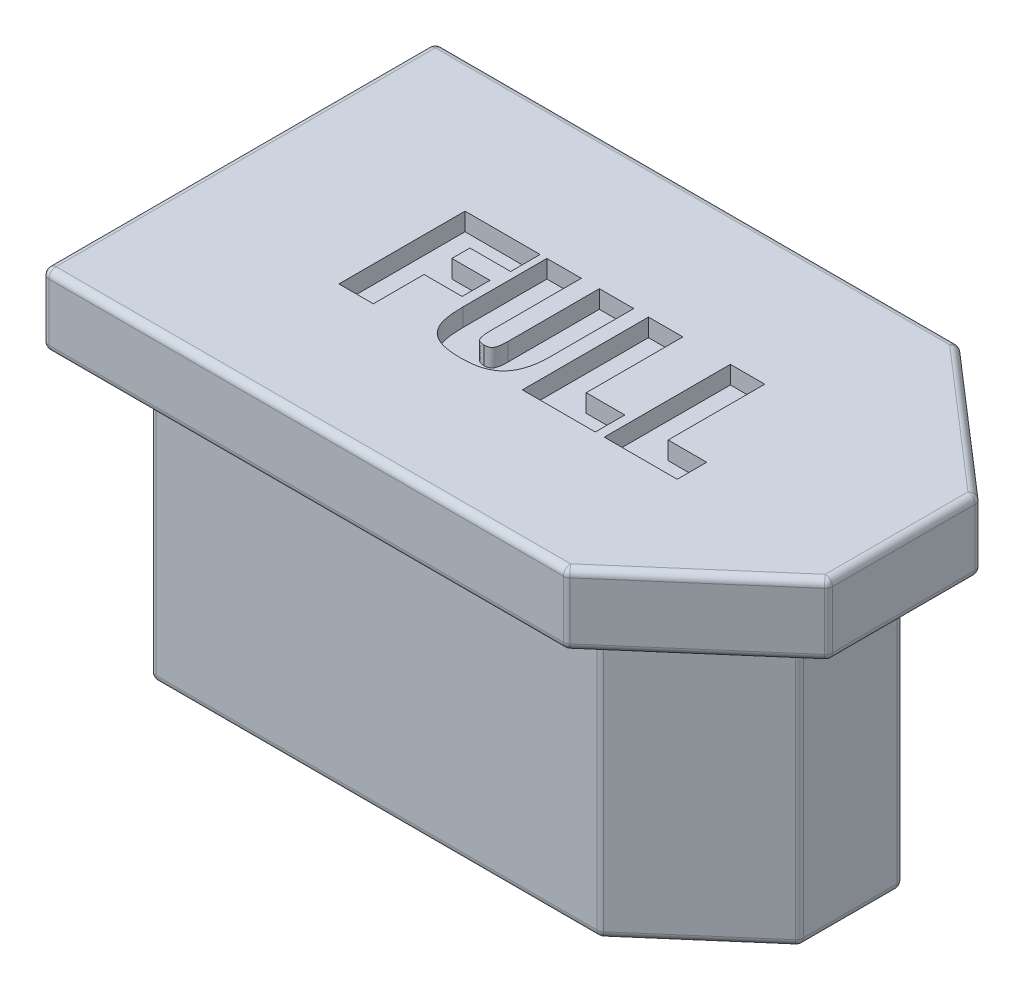
from build123d import *

# Parameters (mm, degrees)
BOSS_EXTRUDE1_DEPTH = 4
SHELL1_T            = -0.8
BOSS_EXTRUDE2_DEPTH = 2
BOSS_EXTRUDE4_REACH = 16.722
SKETCH4_W           = 2
SKETCH4_H           = 1.2
SKETCH5_W           = 1.1
SKETCH5_H           = 4
CUT_EXTRUDE1_DEPTH  = 1
FILLET1_R           = 0.2
CUT_EXTRUDE2_DEPTH  = 0.5


with BuildPart() as part:
    # Sketch1 → Boss-Extrude1 (new, symmetric)
    with BuildSketch(Plane(origin=(0, 0, 0), x_dir=(1, 0, 0), z_dir=(0, 1, 0))):
        Polygon((-7.800231879, 4), (4.799768121, 4), (7.800231879, 1.4), (7.800231879, -1.4), (4.799768121, -4), (-7.800231879, -4), align=None)
    extrude(amount=BOSS_EXTRUDE1_DEPTH, both=True)

    # Shell1
    shell1_openings = [part.faces().sort_by_distance(p)[0] for p in [
        (-0.453398861, 4, 0),
        (-0.453398861, -4, 0),
    ]]
    offset(amount=SHELL1_T, openings=shell1_openings, kind=Kind.INTERSECTION)

    # Sketch2 → Boss-Extrude2 (add)
    with BuildSketch(Plane(origin=(0, 4, 0), x_dir=(1, 0, 0), z_dir=(0, 1, 0))):
        Polygon((-9.300231879, 5.5), (-9.300231879, -5.5), (5.359252751, -5.5), (9.300231879, -2.085012665), (9.300231879, 2.085012665), (5.359252751, 5.5), align=None)
    extrude(amount=BOSS_EXTRUDE2_DEPTH)

    # Sketch4 → Boss-Extrude4 (add, up to next)
    with BuildSketch(Plane.XZ.offset(4), mode=Mode.PRIVATE) as boss_extrude4_sk1:
        with Locations((-0.000231879, -2.6)):
            Rectangle(SKETCH4_W, SKETCH4_H)
    boss_extrude4_tool1 = extrude(boss_extrude4_sk1.sketch, amount=-BOSS_EXTRUDE4_REACH, mode=Mode.PRIVATE) - part.part
    add(boss_extrude4_tool1.solids().sort_by_distance((-0.000232, -4, -2.6))[0])

    # Sketch5 → Cut-Extrude1 (cut)
    with BuildSketch(Plane.XZ.offset(-4)):
        with Locations((-0.000231879, 0)):
            Rectangle(SKETCH5_W, SKETCH5_H)
    extrude(amount=-CUT_EXTRUDE1_DEPTH, mode=Mode.SUBTRACT)

    # Fillet1
    fillet1_edges = [part.edges().sort_by_distance(p)[0] for p in [
        (6.3, 4, 2.7),
        (-7.800231879, 0, -4),
        (4.799768121, 0, -4),
        (7.800231879, 0, -1.4),
        (7.800231879, 0, 1.4),
        (4.799768121, 0, 4),
        (-7.800231879, 0, 4),
        (7.800231879, 4, 0),
        (6.3, 4, -2.7),
        (-1.500231879, 4, -4),
        (-7.000231879, -4, 0),
        (-7.000231879, 0, -3.2),
        (-1.249427781, -4, 3.2),
        (-7.000231879, 0, 3.2),
        (5.750804099, -4, 2.117329956),
        (4.501376318, 0, 3.2),
        (7.000231879, -4, 0),
        (7.000231879, 0, 1.034659912),
        (5.750804099, -4, -2.117329956),
        (7.000231879, 0, -1.034659912),
        (2.750572219, -4, -3.2),
        (4.501376318, 0, -3.2),
        (-7.000231879, 4, 0),
        (-1.249427781, 4, 3.2),
        (5.750804099, 4, 2.117329956),
        (7.000231879, 4, 0),
        (5.750804099, 4, -2.117329956),
        (2.750572219, 4, -3.2),
        (-1.970489564, 4, -5.5),
        (5.359252751, 5, -5.5),
        (-9.300231879, 4, 0),
        (-9.300231879, 5, -5.5),
        (-1.970489564, 4, 5.5),
        (-9.300231879, 5, 5.5),
        (7.329742315, 4, 3.792506333),
        (5.359252751, 5, 5.5),
        (9.300231879, 4, 0),
        (9.300231879, 5, 2.085012665),
        (7.329742315, 4, -3.792506333),
        (9.300231879, 5, -2.085012665),
        (-1.970489564, 6, -5.5),
        (-9.300231879, 6, 0),
        (-1.970489564, 6, 5.5),
        (7.329742315, 6, 3.792506333),
        (-7.800231879, 4, 0),
        (9.300231879, 6, 0),
        (7.329742315, 6, -3.792506333),
        (-4.000231879, 4, -3.2),
        (-1.500231879, -4, -4),
        (-4.000231879, -4, -3.2),
        (0.999768121, 0, -3.2),
        (-1.000231879, 4, -2.6),
        (-1.000231879, 0, -3.2),
        (0.774768121, 4, -2),
        (-1.000231879, 0, -2),
        (0.999768121, 4, -2.6),
        (0.999768121, 0, -2),
        (0.999768121, -4, -2.6),
        (-0.000231879, -4, -2),
        (-1.000231879, -4, -2.6),
        (6.3, -4, -2.7),
        (7.800231879, -4, 0),
        (-1.500231879, 4, 4),
        (6.3, -4, 2.7),
        (-0.775231879, 4, -2),
        (-1.500231879, -4, 4),
        (-0.000231879, 5, -2),
        (0.549768121, 4.5, -2),
        (-0.550231879, 5, 0),
        (-0.550231879, 4.5, -2),
        (-0.000231879, 5, 2),
        (-0.550231879, 4.5, 2),
        (0.549768121, 5, 0),
        (0.549768121, 4.5, 2),
        (0.549768121, 4, 0),
        (-0.000231879, 4, 2),
        (-0.550231879, 4, 0),
        (-7.800231879, -4, 0),
    ]]
    fillet(fillet1_edges, radius=FILLET1_R)

    # Sketch6 → Cut-Extrude2 (cut)
    with BuildSketch(Plane(origin=(0, 6, 0), x_dir=(1, 0, 0), z_dir=(0, 1, 0))):
        Polygon((-4.729610488, 1.763183333), (-2.630105658, 1.763183333), (-2.630105658, 0.938837879), (-3.767874124, 0.938837879), (-3.767874124, 0.435071212), (-2.704525734, 0.435071212), (-2.704525734, -0.343477273), (-3.767874124, -0.343477273), (-3.767874124, -1.763183333), (-4.729610488, -1.763183333), align=None)
        with BuildLine():
            Line((-0.974258973, 1.763183333), (-0.012522609, 1.763183333))
            Line((-0.012522609, 1.763183333), (-0.012522609, -0.582480208))
            add(Edge.make_bspline(
                [(-0.012522609, -0.582480208), (-0.013074538, -0.682044341), (-0.018871843, -0.827349384), (-0.050027891, -1.012483298), (-0.079237437, -1.137533649), (-0.118839295, -1.252460511), (-0.16648501, -1.357917428), (-0.224210632, -1.452631609), (-0.289561949, -1.538412572), (-0.365653341, -1.614171941), (-0.454278799, -1.678748395), (-0.554132011, -1.734173119), (-0.666295124, -1.777972128), (-0.789297045, -1.813476639), (-0.97670379, -1.845869926), (-1.124212944, -1.855100896), (-1.226142306, -1.854777273)],
                knots=[0, 0, 0, 0, 0.147091771, 0.213812555, 0.276818101, 0.336371325, 0.392915056, 0.447245077, 0.499696578, 0.551716391, 0.605080018, 0.661012388, 0.719773935, 0.782386932, 0.849634869, 1, 1, 1, 1], degree=3))
            add(Edge.make_bspline(
                [(-1.226142306, -1.854777273), (-1.335696933, -1.853598838), (-1.493540599, -1.848307146), (-1.691465292, -1.815233765), (-1.818090486, -1.783702772), (-1.930740252, -1.741372046), (-2.030450296, -1.687980633), (-2.118686541, -1.624868177), (-2.195040699, -1.550915118), (-2.259157986, -1.465805045), (-2.312988749, -1.370783365), (-2.356155802, -1.265216152), (-2.387752365, -1.148963406), (-2.410650726, -1.022432395), (-2.434574705, -0.832987442), (-2.439081919, -0.684631157), (-2.439762003, -0.582480208)],
                knots=[0, 0, 0, 0, 0.159500308, 0.228770628, 0.291433921, 0.348949481, 0.403253485, 0.455420347, 0.506186304, 0.557166208, 0.609816123, 0.664556878, 0.722530636, 0.784630014, 0.851388542, 1, 1, 1, 1], degree=3))
            Line((-2.439762003, -0.582480208), (-2.439762003, 1.763183333))
            Line((-2.439762003, 1.763183333), (-1.478025639, 1.763183333))
            Line((-1.478025639, 1.763183333), (-1.478025639, -0.784273106))
            add(Edge.make_bspline(
                [(-1.478025639, -0.784273106), (-1.47702952, -0.850008176), (-1.475898145, -0.94203407), (-1.453854653, -1.051706798), (-1.43524811, -1.112642268), (-1.403845733, -1.160637829), (-1.335235205, -1.205975479), (-1.270259157, -1.213013376), (-1.226142306, -1.213619697)],
                knots=[0, 0, 0, 0, 0.343473968, 0.475215467, 0.581631525, 0.673591657, 0.767279203, 1, 1, 1, 1], degree=3))
            add(Edge.make_bspline(
                [(-1.226142306, -1.213619697), (-1.182025455, -1.213013376), (-1.117049407, -1.205975479), (-1.048438879, -1.160637829), (-1.017036501, -1.112642268), (-0.998429959, -1.051706798), (-0.976386467, -0.94203407), (-0.975255092, -0.850008176), (-0.974258973, -0.784273106)],
                knots=[0, 0, 0, 0, 0.232720797, 0.326408343, 0.418368475, 0.524784533, 0.656526032, 1, 1, 1, 1], degree=3))
            Line((-0.974258973, -0.784273106), (-0.974258973, 1.763183333))
        make_face()
        Polygon((0.399650118, 1.763183333), (1.361386482, 1.763183333), (1.361386482, -0.938837879), (2.439762003, -0.938837879), (2.439762003, -1.763183333), (0.399650118, -1.763183333), align=None)
        Polygon((2.689498603, 1.763183333), (3.651234967, 1.763183333), (3.651234967, -0.938837879), (4.729610488, -0.938837879), (4.729610488, -1.763183333), (2.689498603, -1.763183333), align=None)
    extrude(amount=-CUT_EXTRUDE2_DEPTH, mode=Mode.SUBTRACT)


solid = part.part
